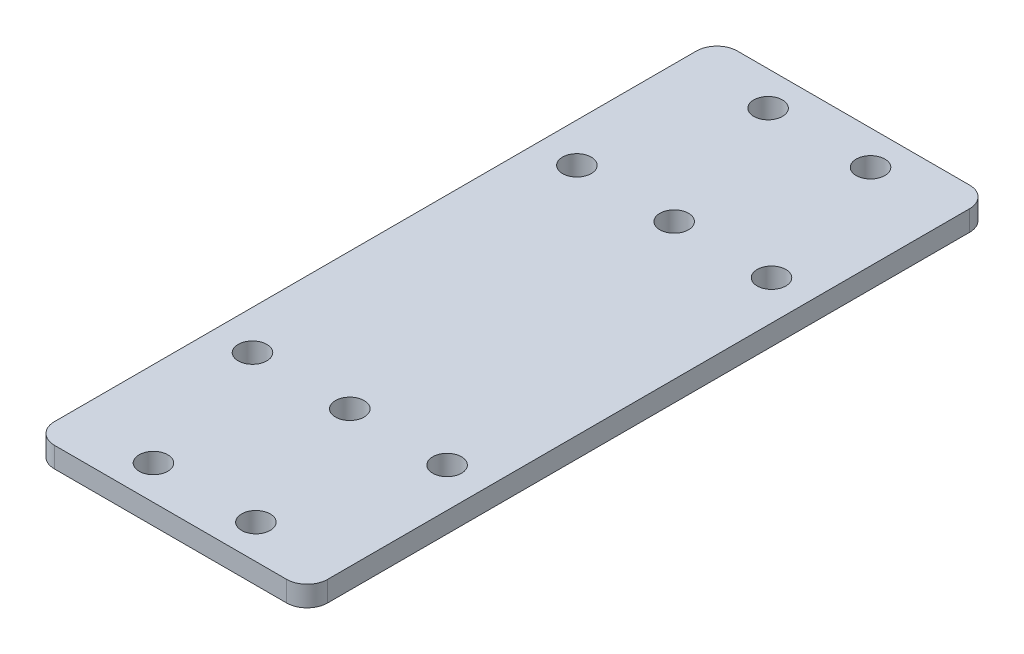
from build123d import *

# Parameters (mm, degrees)
SKETCH_1_W      = 40
SKETCH_1_H      = 100
SKETCH_1_R      = 2.1
EXTRUDE_1_DEPTH = 3
FILLET_1_R      = 3


with BuildPart() as part:
    # ｽｹｯﾁ1 → ﾎﾞｽ - 押し出し1 (new body)
    with BuildSketch(Plane(origin=(0, 0, 0), x_dir=(1, 0, 0), z_dir=(0, 1, 0))):
        Rectangle(SKETCH_1_W, SKETCH_1_H)
        with Locations(Location((14.25, 23.75, 0), (0, 0, 270))):
            Circle(SKETCH_1_R, mode=Mode.SUBTRACT)
        with Locations(Location((-14.25, 23.75, 0), (0, 0, 90))):
            Circle(SKETCH_1_R, mode=Mode.SUBTRACT)
        with Locations(Location((-14.25, -23.75, 0), (0, 0, 270))):
            Circle(SKETCH_1_R, mode=Mode.SUBTRACT)
        with Locations(Location((14.25, -23.75, 0), (0, 0, 90))):
            Circle(SKETCH_1_R, mode=Mode.SUBTRACT)
        with Locations(Location((7.5, 45, 0), (0, 0, 270))):
            Circle(SKETCH_1_R, mode=Mode.SUBTRACT)
        with Locations(Location((-7.5, 45, 0), (0, 0, 90))):
            Circle(SKETCH_1_R, mode=Mode.SUBTRACT)
        with Locations(Location((-7.5, -45, 0), (0, 0, 270))):
            Circle(SKETCH_1_R, mode=Mode.SUBTRACT)
        with Locations(Location((7.5, -45, 0), (0, 0, 90))):
            Circle(SKETCH_1_R, mode=Mode.SUBTRACT)
        with Locations(Location((0, 23.75, 0), (0, 0, 270))):
            Circle(SKETCH_1_R, mode=Mode.SUBTRACT)
        with Locations(Location((0, -23.75, 0), (0, 0, 90))):
            Circle(SKETCH_1_R, mode=Mode.SUBTRACT)
    extrude(amount=EXTRUDE_1_DEPTH)

    # ﾌｨﾚｯﾄ1
    fillet_1_edges = [part.edges().sort_by_distance(p)[0] for p in [
        (20, 1.5, 50),
        (-20, 1.5, 50),
        (-20, 1.5, -50),
        (20, 1.5, -50),
    ]]
    fillet(fillet_1_edges, radius=FILLET_1_R)


solid = part.part
